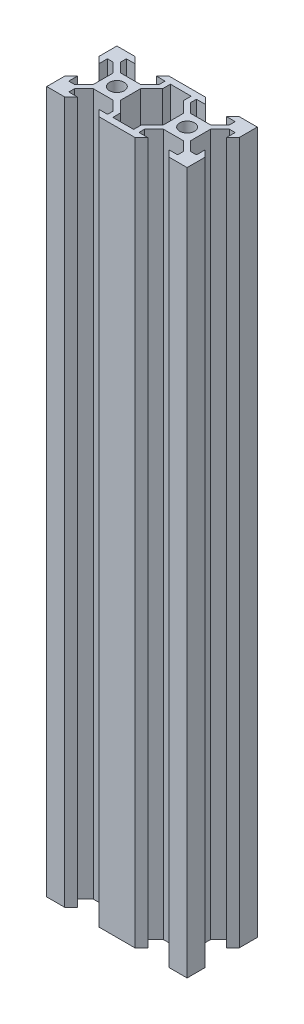
from build123d import *

# Parameters (mm, degrees)
SKETCH1_R           = 2.1
BOSS_EXTRUDE1_DEPTH = 200


with BuildPart() as part:
    # Sketch1 → Boss-Extrude1 (new body)
    with BuildSketch(Plane(origin=(0, 0, 0), x_dir=(1, 0, 0), z_dir=(0, 1, 0))):
        Polygon((1.8, 15.5), (1.8, 13.1), (0, 14.9), (0, 20), (5.1, 20), (6.9, 18.2), (4.5, 18.2), (4.5, 16.560660172), (7.190031555, 13.870628617), (12.839339828, 13.870628617), (15.529414018, 16.560702806), (15.529414018, 18.2), (13.1, 18.2), (14.9, 20), (25.280697212, 20), (27.080697212, 18.2), (24.470585982, 18.2), (24.470585982, 16.560702806), (27.160660172, 13.870628617), (32.809968445, 13.870628617), (35.5, 16.560660172), (35.5, 18.2), (33.1, 18.2), (34.9, 20), (40, 20), (40, 14.9), (38.2, 13.1), (38.2, 15.5), (36.560660172, 15.5), (33.870585982, 12.809925811), (33.870585982, 7.160617537), (36.560617537, 4.470585982), (38.2, 4.470585982), (38.2, 6.9), (40, 5.1), (40, 0), (34.9, 0), (33.1, 1.8), (35.499957366, 1.8), (35.499957366, 3.409925811), (32.809883176, 6.1), (27.160574903, 6.1), (24.470543348, 3.409968445), (24.470543348, 1.8), (27, 1.8), (25.2, 0), (14.9, 0), (13.1, 1.8), (15.529456652, 1.8), (15.529456652, 3.409968445), (12.839425097, 6.1), (7.190116824, 6.1), (4.500042634, 3.409925811), (4.500042634, 1.8), (6.9, 1.8), (5.1, 0), (0, 0), (0, 5.1), (1.8, 6.9), (1.8, 4.470585982), (3.439382463, 4.470585982), (6.129414018, 7.160617537), (6.129414018, 12.809925811), (3.439339828, 15.5), align=None)
        with Locations(Location((10, 10, 0), (0, 0, 270))):
            Circle(SKETCH1_R, mode=Mode.SUBTRACT)
        with Locations(Location((30, 10, 0), (0, 0, 90))):
            Circle(SKETCH1_R, mode=Mode.SUBTRACT)
        Polygon((13.900042634, 7.175345863), (13.900042634, 12.824654137), (17.029456652, 15.964292458), (17.039482597, 18.2), (22.960517403, 18.2), (22.970543348, 15.964292458), (26.099957366, 12.824654137), (26.099957366, 7.175345863), (22.970543348, 4.035707542), (22.970543348, 1.8), (17.029456652, 1.8), (17.029456652, 4.035707542), align=None, mode=Mode.SUBTRACT)
    extrude(amount=BOSS_EXTRUDE1_DEPTH)


solid = part.part
